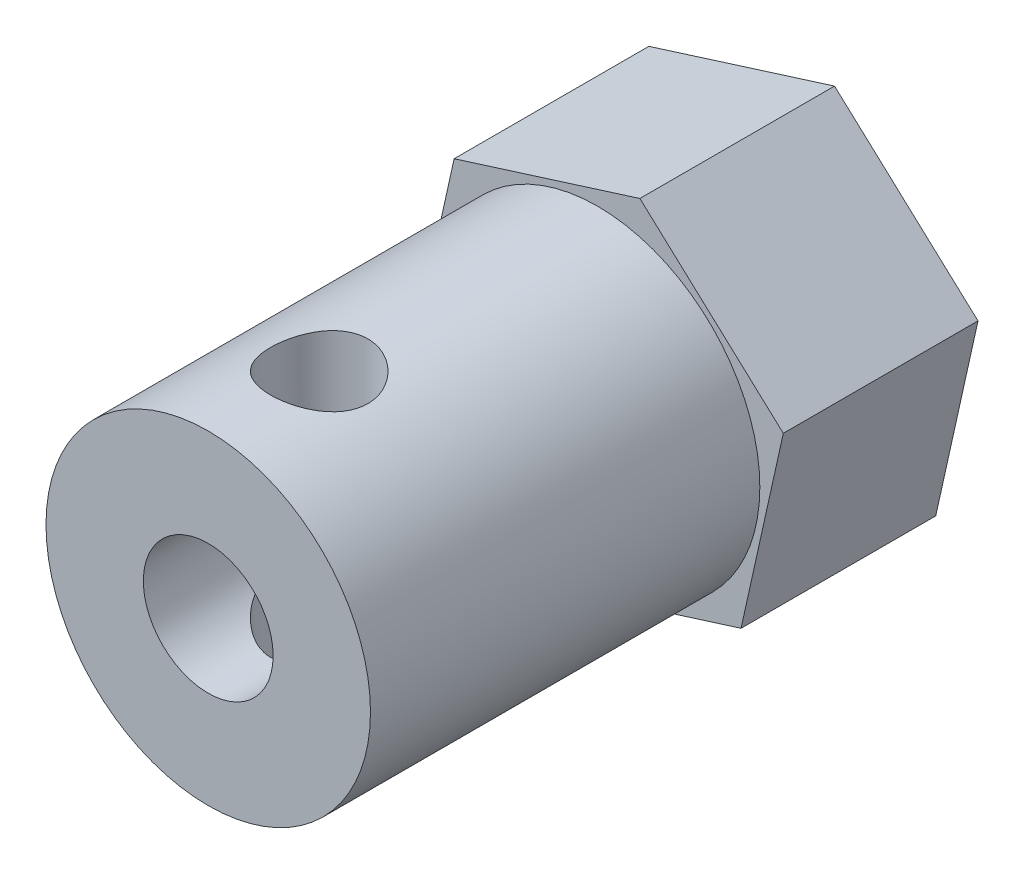
from build123d import *

# Parameters (mm, degrees)
BOSS_EXTRUDE2_DEPTH = 6
SKETCH4_R           = 5
BOSS_EXTRUDE3_DEPTH = 12
SKETCH5_R           = 1.5
CUT_EXTRUDE1_DEPTH  = 6
SKETCH6_R           = 2
CUT_EXTRUDE2_DEPTH  = 12
SKETCH7_R           = 1.5
CUT_EXTRUDE3_DEPTH  = 10


with BuildPart() as part:
    # Sketch3 → Boss-Extrude2 (new body)
    with BuildSketch(Plane.XY):
        Polygon((-4.420907708, 4.056547182), (-5.723526765, -1.800344791), (-1.302619058, -5.856891974), (4.420907708, -4.056547182), (5.723526765, 1.800344791), (1.302619058, 5.856891974), align=None)
    extrude(amount=BOSS_EXTRUDE2_DEPTH)

    # Sketch4 → Boss-Extrude3 (add)
    with BuildSketch(Plane.XY.offset(6)):
        Circle(SKETCH4_R)
    extrude(amount=BOSS_EXTRUDE3_DEPTH)

    # Sketch5 → Cut-Extrude1 (cut, symmetric)
    with BuildSketch(Plane(origin=(0, 0, 0), x_dir=(1, 0, 0), z_dir=(0, 1, 0))):
        with Locations(Location((0, -14.580477712, 0), (0, 0, 270))):
            Circle(SKETCH5_R)
    extrude(amount=CUT_EXTRUDE1_DEPTH, both=True, mode=Mode.SUBTRACT)

    # Sketch6 → Cut-Extrude2 (cut)
    with BuildSketch(Plane.XY.offset(18)):
        Circle(SKETCH6_R)
    extrude(amount=-CUT_EXTRUDE2_DEPTH, mode=Mode.SUBTRACT)

    # Sketch7 → Cut-Extrude3 (cut)
    with BuildSketch(Plane(origin=(0, 0, 0), x_dir=(-1, 0, 0), z_dir=(0, 0, -1))):
        Circle(SKETCH7_R)
    extrude(amount=-CUT_EXTRUDE3_DEPTH, mode=Mode.SUBTRACT)


solid = part.part
